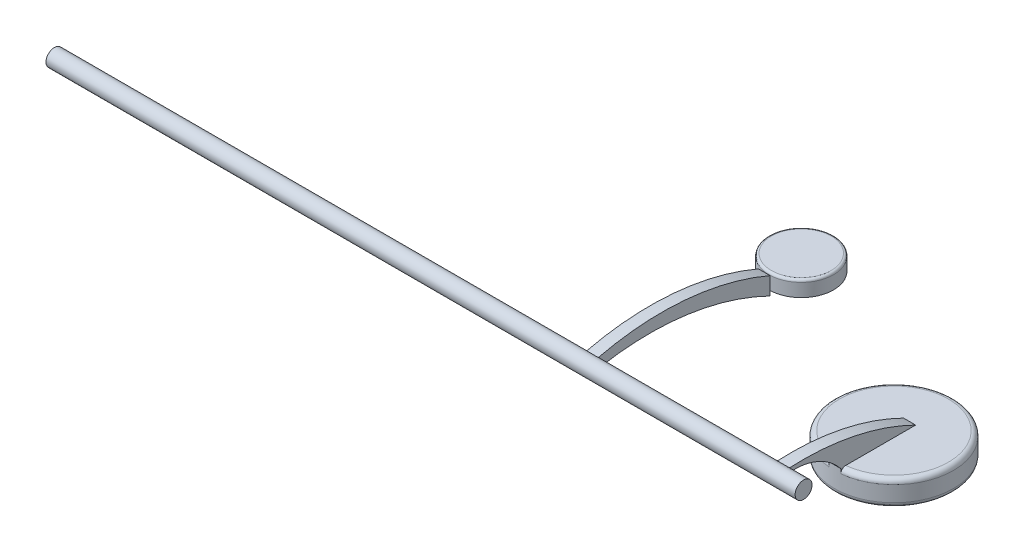
from build123d import *

# Parameters (mm, degrees)
SKETCH1_R           = 2.2225
BOSS_EXTRUDE1_DEPTH = 196.85
BOSS_EXTRUDE2_DEPTH = 3.175
SKETCH3_R           = 15.621
BOSS_EXTRUDE3_DEPTH = 6.6548
FILLET1_R           = 1.27
BOSS_EXTRUDE4_DEPTH = 3.048
SKETCH7_W           = 8.4836
SKETCH7_H           = 4.098529722
FILLET3_R           = 0.635


with BuildPart() as part:
    # Sketch1 → Boss-Extrude1 (new body)
    with BuildSketch(Plane(origin=(0, 0, 0), x_dir=(0, 0, -1), z_dir=(1, 0, 0))):
        Circle(SKETCH1_R)
    extrude(amount=BOSS_EXTRUDE1_DEPTH)

    # Sketch2 → Boss-Extrude2 (add)
    with BuildSketch(Plane(origin=(191.3128, 0, 0), x_dir=(0, 0, -1), z_dir=(1, 0, 0))):
        with BuildLine():
            Line((15.24, -5.5372), (34.9758, -5.5372))
            ThreePointArc((34.9758, -5.5372), (17.942872857, 0.189759615), (0, 1.175653677))
            Line((0, 1.175653677), (0, 0))
            ThreePointArc((0, 0), (8.40347241, -0.612253918), (15.24, -5.5372))
        make_face()
    extrude(amount=-BOSS_EXTRUDE2_DEPTH)

    # Sketch3 → Boss-Extrude3 (add)
    with BuildSketch(Plane.XZ.offset(5.5372)):
        with Locations(Location((189.7253, -30.861, 0), (0, 0, 90))):
            Circle(SKETCH3_R)
    extrude(amount=BOSS_EXTRUDE3_DEPTH)

    # Fillet1
    fillet1_edges = [part.edges().sort_by_distance(p)[0] for p in [
        (189.7253, -5.5372, -46.482),
        (189.7253, -12.192, -46.482),
    ]]
    fillet(fillet1_edges, radius=FILLET1_R)

    # Sketch6 → Boss-Extrude4 (add)
    with BuildSketch(Plane.ZY.offset(-141.5542)):
        with BuildLine():
            Line((-46.482, -6.8072), (-46.482, -2.159))
            ThreePointArc((-46.482, -2.159), (-23.539538891, 3.501677184), (0, 1.430470604))
            Line((0, 1.430470604), (0, -1.036494262))
            ThreePointArc((0, -1.036494262), (-23.724853498, -0.024493963), (-46.482, -6.8072))
        make_face()
    extrude(amount=BOSS_EXTRUDE4_DEPTH)


with BuildPart() as body_2:
    # Sketch7 → Revolve1 (revolve)
    with BuildSketch(Plane.ZY.offset(-140.0302), mode=Mode.PRIVATE) as revolve1_sk:
        with Locations((-51.967415937, -4.757935139)):
            Rectangle(SKETCH7_W, SKETCH7_H)
    revolve(revolve1_sk.sketch.rotate(Axis((140.0302, -6.8072, -56.209215937), (0, 1, 0)), 180), axis=Axis((140.0302, -6.8072, -56.209215937), (0, 1, 0)))

    # Fillet3
    fillet3_edges = [body_2.edges().sort_by_distance(p)[0] for p in [
        (140.0302, -2.708670278, -47.725615937),
    ]]
    fillet(fillet3_edges, radius=FILLET3_R)


solid = Compound([part.part, body_2.part])
